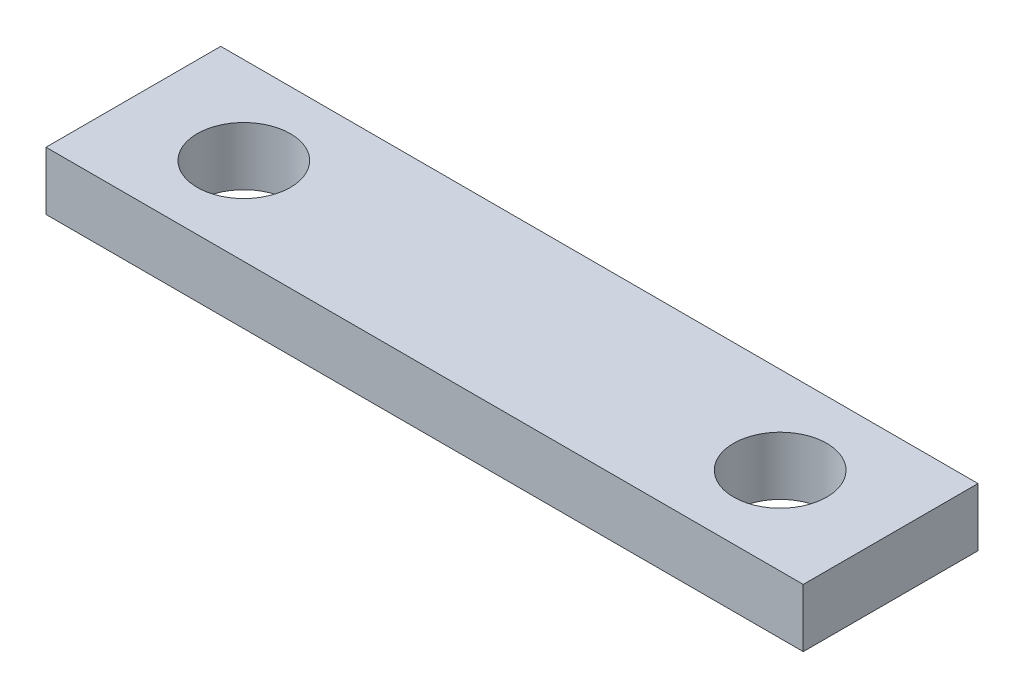
from build123d import *

# Parameters (mm, degrees)
SKETCH1_W           = 65
SKETCH1_H           = 15
SKETCH1_R           = 4
BOSS_EXTRUDE1_DEPTH = 5


with BuildPart() as part:
    # Sketch1 → Boss-Extrude1 (new body)
    with BuildSketch(Plane(origin=(0, 0, 0), x_dir=(1, 0, 0), z_dir=(0, 1, 0))):
        Rectangle(SKETCH1_W, SKETCH1_H)
        with Locations(Location((23.02, 0, 0), (0, 0, 270))):
            Circle(SKETCH1_R, mode=Mode.SUBTRACT)
        with Locations(Location((-23.02, 0, 0), (0, 0, 90))):
            Circle(SKETCH1_R, mode=Mode.SUBTRACT)
    extrude(amount=BOSS_EXTRUDE1_DEPTH)


solid = part.part
